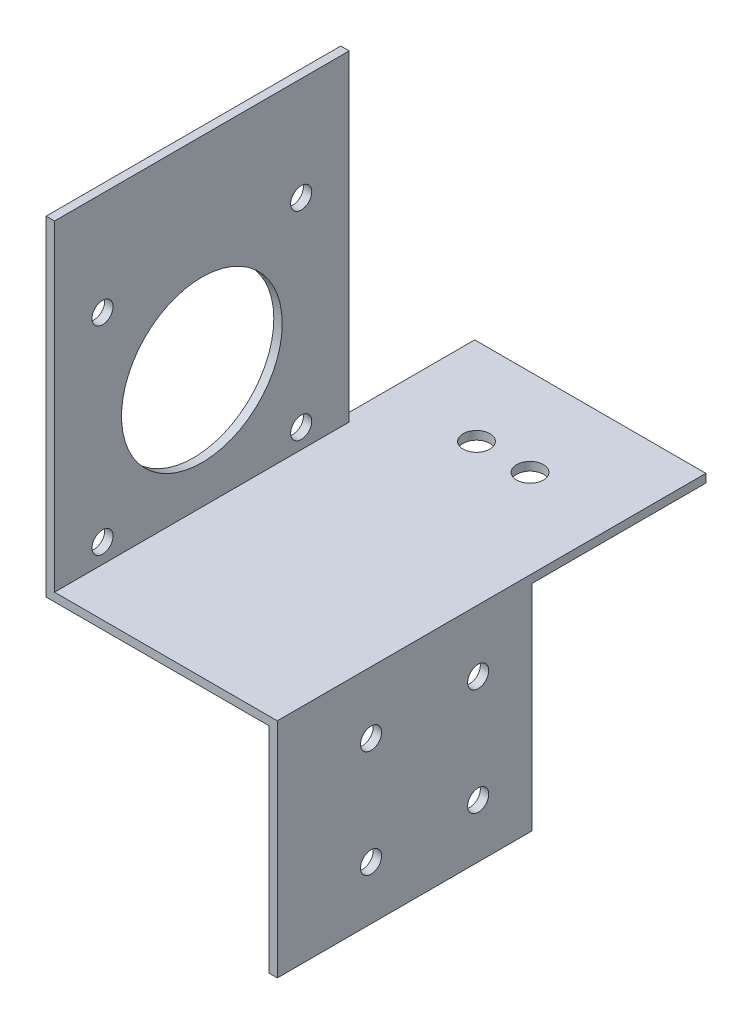
from build123d import *

# Parameters (mm, degrees)
SKETCH1_W           = 69.85
SKETCH1_H           = 50.8
BOSS_EXTRUDE1_DEPTH = 2
SKETCH2_W           = 54.8
SKETCH2_H           = 69.85
BOSS_EXTRUDE2_DEPTH = 2
SKETCH3_W           = 2
SKETCH3_H           = 69.85
BOSS_EXTRUDE3_DEPTH = 76.2
SKETCH4_R           = 19.05
SKETCH4_R_2         = 2.5
CUT_EXTRUDE1_DEPTH  = 122.410689912
SKETCH5_R           = 2.5
SKETCH5_W           = 9.525
SKETCH5_H           = 52.8
CUT_EXTRUDE2_DEPTH  = 76.2
SKETCH6_W           = 54.8
SKETCH6_H           = 2
BOSS_EXTRUDE4_DEPTH = 41.275
SKETCH7_R           = 3.175
CUT_EXTRUDE3_DEPTH  = 116.130515612


with BuildPart() as part:
    # Sketch1 → Boss-Extrude1 (new body)
    with BuildSketch(Plane(origin=(0, 0, 0), x_dir=(0, 0, -1), z_dir=(1, 0, 0))):
        Rectangle(SKETCH1_W, SKETCH1_H)
    extrude(amount=-BOSS_EXTRUDE1_DEPTH)

    # Sketch2 → Boss-Extrude2 (add)
    with BuildSketch(Plane(origin=(0, 25.4, 0), x_dir=(1, 0, 0), z_dir=(0, 1, 0))):
        with Locations((-27.4, 0)):
            Rectangle(SKETCH2_W, SKETCH2_H)
    extrude(amount=BOSS_EXTRUDE2_DEPTH)

    # Sketch3 → Boss-Extrude3 (add)
    with BuildSketch(Plane(origin=(0, 27.4, 0), x_dir=(1, 0, 0), z_dir=(0, 1, 0))):
        with Locations((-53.8, 0)):
            Rectangle(SKETCH3_W, SKETCH3_H)
    extrude(amount=BOSS_EXTRUDE3_DEPTH)

    # Sketch4 → Cut-Extrude1 (cut, through all)
    with BuildSketch(Plane(origin=(-52.8, 0, 0), x_dir=(0, 0, -1), z_dir=(1, 0, 0))):
        with Locations((0, 55.567958179)):
            Circle(SKETCH4_R)
        with Locations((23.55, 79.117958179)):
            Circle(SKETCH4_R_2)
        with Locations((-23.55, 79.117958179)):
            Circle(SKETCH4_R_2)
        with Locations((-23.55, 32.017958179)):
            Circle(SKETCH4_R_2)
        with Locations((23.55, 32.017958179)):
            Circle(SKETCH4_R_2)
    extrude(amount=-CUT_EXTRUDE1_DEPTH, mode=Mode.SUBTRACT)

    # Sketch5 → Cut-Extrude2 (cut)
    with BuildSketch(Plane(origin=(0, 0, 0), x_dir=(0, 0, -1), z_dir=(1, 0, 0))):
        with Locations((-12.7, 12.7)):
            Circle(SKETCH5_R)
        with Locations((12.7, 12.7)):
            Circle(SKETCH5_R)
        with Locations((12.7, -12.7)):
            Circle(SKETCH5_R)
        with Locations((-12.7, -12.7)):
            Circle(SKETCH5_R)
        with Locations((30.1625, 1)):
            Rectangle(SKETCH5_W, SKETCH5_H)
    extrude(amount=-CUT_EXTRUDE2_DEPTH, mode=Mode.SUBTRACT)

    # Sketch6 → Boss-Extrude4 (add)
    with BuildSketch(Plane(origin=(0, 0, -25.4), x_dir=(-1, 0, 0), z_dir=(0, 0, -1))):
        with Locations((27.4, 26.4)):
            Rectangle(SKETCH6_W, SKETCH6_H)
    extrude(amount=BOSS_EXTRUDE4_DEPTH)

    # Sketch7 → Cut-Extrude3 (cut, through all)
    with BuildSketch(Plane(origin=(0, 27.4, 0), x_dir=(1, 0, 0), z_dir=(0, 1, 0))):
        with Locations(Location((-33.75, 46.0375, 0), (0, 0, 270))):
            Circle(SKETCH7_R)
        with Locations(Location((-21.05, 46.0375, 0), (0, 0, 270))):
            Circle(SKETCH7_R)
    extrude(amount=-CUT_EXTRUDE3_DEPTH, mode=Mode.SUBTRACT)


solid = part.part
